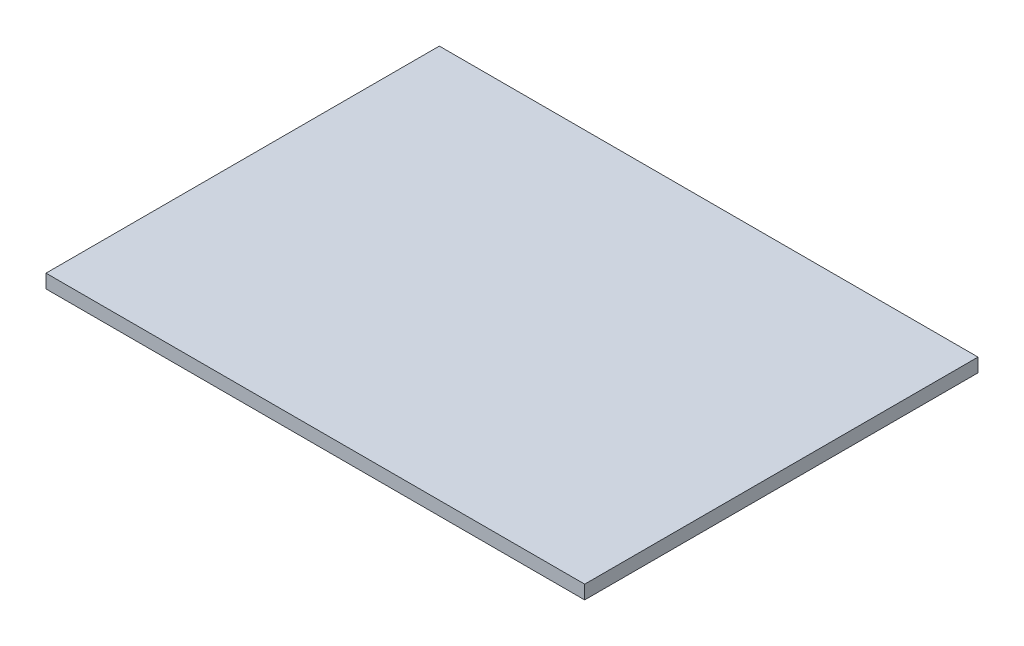
from build123d import *

# Parameters (mm, degrees)
SKETCH1_W           = 63
SKETCH1_H           = 46
BOSS_EXTRUDE1_DEPTH = 1.6


with BuildPart() as part:
    # Sketch1 → Boss-Extrude1 (new body)
    with BuildSketch(Plane(origin=(0, 0, 0), x_dir=(1, 0, 0), z_dir=(0, 1, 0))):
        with Locations((31.5, 23)):
            Rectangle(SKETCH1_W, SKETCH1_H)
    extrude(amount=BOSS_EXTRUDE1_DEPTH)


solid = part.part
